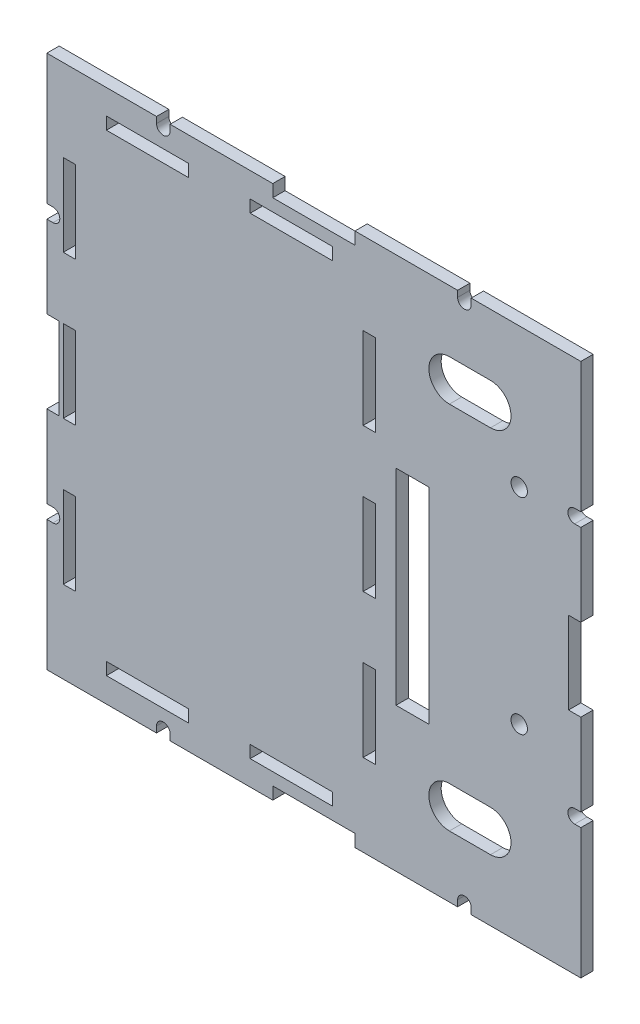
from build123d import *

# Parameters (mm, degrees)
SKETCH1_W           = 20
SKETCH1_H           = 3
SKETCH1_W_2         = 3
SKETCH1_H_2         = 20
SKETCH1_W_3         = 8
SKETCH1_H_3         = 50
SKETCH1_R           = 2
BOSS_EXTRUDE1_DEPTH = 3


with BuildPart() as part:
    # Sketch1 → Boss-Extrude1 (new body)
    with BuildSketch(Plane.XY):
        with BuildLine():
            Line((10, -62), (10, -65))
            Line((10, -65), (35, -65))
            Line((35, -65), (35, -63.5))
            ThreePointArc((35, -63.5), (36.65, -61.85), (38.3, -63.5))
            Line((38.3, -63.5), (38.3, -65))
            Line((38.3, -65), (65, -65))
            Line((65, -65), (65, -33.3))
            Line((65, -33.3), (63.5, -33.3))
            ThreePointArc((63.5, -33.3), (61.85, -31.65), (63.5, -30))
            Line((63.5, -30), (65, -30))
            Line((65, -30), (65, -10))
            Line((65, -10), (62, -10))
            Line((62, -10), (62, 10))
            Line((62, 10), (65, 10))
            Line((65, 10), (65, 30))
            Line((65, 30), (63.5, 30))
            ThreePointArc((63.5, 30), (61.85, 31.65), (63.5, 33.3))
            Line((63.5, 33.3), (65, 33.3))
            Line((65, 33.3), (65, 65))
            Line((65, 65), (38.3, 65))
            Line((38.3, 65), (38.3, 63.5))
            ThreePointArc((38.3, 63.5), (36.65, 61.85), (35, 63.5))
            Line((35, 63.5), (35, 65))
            Line((35, 65), (10, 65))
            Line((10, 65), (10, 62))
            Line((10, 62), (-10, 62))
            Line((-10, 62), (-10, 65))
            Line((-10, 65), (-35, 65))
            Line((-35, 65), (-35, 63.5))
            ThreePointArc((-35, 63.5), (-36.65, 61.85), (-38.3, 63.5))
            Line((-38.3, 63.5), (-38.3, 65))
            Line((-38.3, 65), (-65, 65))
            Line((-65, 65), (-65, 33.3))
            Line((-65, 33.3), (-63.5, 33.3))
            ThreePointArc((-63.5, 33.3), (-61.85, 31.65), (-63.5, 30))
            Line((-63.5, 30), (-65, 30))
            Line((-65, 30), (-65, 10))
            Line((-65, 10), (-62, 10))
            Line((-62, 10), (-62, -10))
            Line((-62, -10), (-65, -10))
            Line((-65, -10), (-65, -30))
            Line((-65, -30), (-63.5, -30))
            ThreePointArc((-63.5, -30), (-61.85, -31.65), (-63.5, -33.3))
            Line((-63.5, -33.3), (-65, -33.3))
            Line((-65, -33.3), (-65, -65))
            Line((-65, -65), (-38.3, -65))
            Line((-38.3, -65), (-38.3, -63.5))
            ThreePointArc((-38.3, -63.5), (-36.65, -61.85), (-35, -63.5))
            Line((-35, -63.5), (-35, -65))
            Line((-35, -65), (-10, -65))
            Line((-10, -65), (-10, -62))
            Line((-10, -62), (10, -62))
        make_face()
        with Locations((-40.5, -57.5)):
            Rectangle(SKETCH1_W, SKETCH1_H, mode=Mode.SUBTRACT)
        with Locations((-59.5, -35)):
            Rectangle(SKETCH1_W_2, SKETCH1_H_2, mode=Mode.SUBTRACT)
        with Locations((-5.5, -57.5)):
            Rectangle(SKETCH1_W, SKETCH1_H, mode=Mode.SUBTRACT)
        with Locations((13.5, -35)):
            Rectangle(SKETCH1_W_2, SKETCH1_H_2, mode=Mode.SUBTRACT)
        with BuildLine():
            Line((33, -40), (43, -40))
            ThreePointArc((43, -40), (48, -45), (43, -50))
            Line((43, -50), (33, -50))
            ThreePointArc((33, -50), (28, -45), (33, -40))
        make_face(mode=Mode.SUBTRACT)
        with Locations((24, -5)):
            Rectangle(SKETCH1_W_3, SKETCH1_H_3, mode=Mode.SUBTRACT)
        with Locations((50, -19)):
            Circle(SKETCH1_R, mode=Mode.SUBTRACT)
        with Locations((-59.5, 0)):
            Rectangle(SKETCH1_W_2, SKETCH1_H_2, mode=Mode.SUBTRACT)
        with Locations((-59.5, 35)):
            Rectangle(SKETCH1_W_2, SKETCH1_H_2, mode=Mode.SUBTRACT)
        with Locations((-40.5, 57.5)):
            Rectangle(SKETCH1_W, SKETCH1_H, mode=Mode.SUBTRACT)
        with Locations((-5.5, 57.5)):
            Rectangle(SKETCH1_W, SKETCH1_H, mode=Mode.SUBTRACT)
        with Locations((13.5, 0)):
            Rectangle(SKETCH1_W_2, SKETCH1_H_2, mode=Mode.SUBTRACT)
        with Locations((50, 31)):
            Circle(SKETCH1_R, mode=Mode.SUBTRACT)
        with Locations((13.5, 35)):
            Rectangle(SKETCH1_W_2, SKETCH1_H_2, mode=Mode.SUBTRACT)
        with BuildLine():
            ThreePointArc((43, 50), (48, 45), (43, 40))
            Line((43, 40), (33, 40))
            ThreePointArc((33, 40), (28, 45), (33, 50))
            Line((33, 50), (43, 50))
        make_face(mode=Mode.SUBTRACT)
    extrude(amount=BOSS_EXTRUDE1_DEPTH)


solid = part.part
